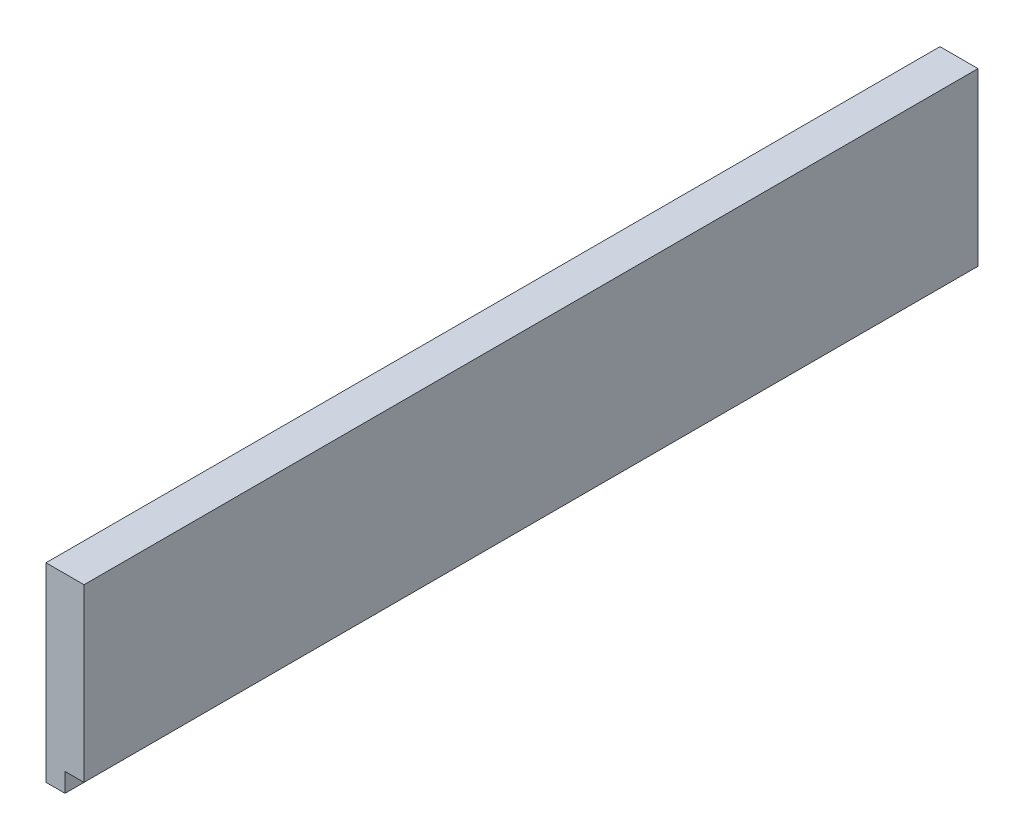
from build123d import *

# Parameters (mm, degrees)
EXTRUDE_1_DEPTH = 470


with BuildPart() as part:
    # Эскиз1 → Бобышка-Вытянуть1 (new body)
    with BuildSketch(Plane.XY):
        Polygon((0, 0), (0, 100), (20, 100), (20, 10), (10, 10), (10, 0), align=None)
    extrude(amount=EXTRUDE_1_DEPTH)


solid = part.part
